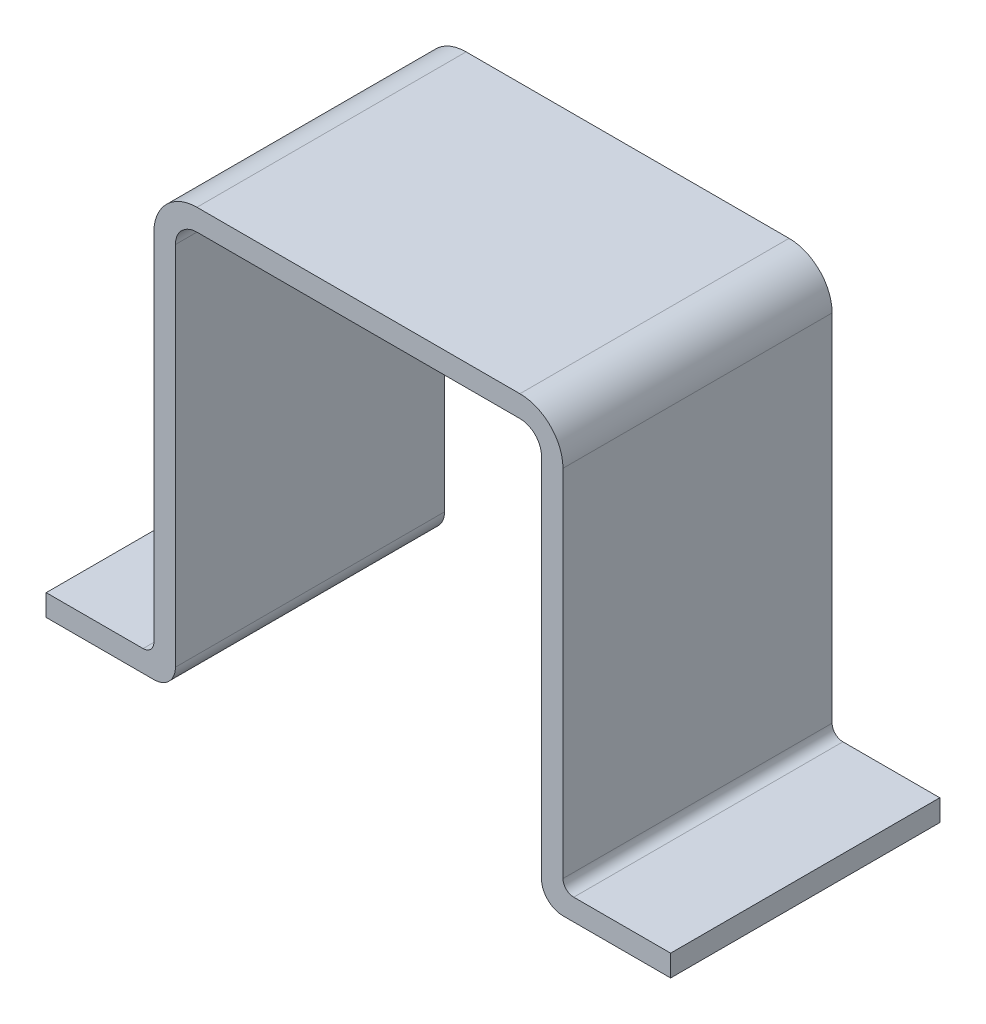
from build123d import *

# Parameters (mm, degrees)
EXTRU_MINCE1_DEPTH = 25
CONG_1_R           = 1


with BuildPart() as part:
    # Esquisse1 → Extru.-Mince1 (new body)
    with BuildSketch(Plane.XY):
        with BuildLine():
            Line((-32.373305915, 0), (-22.373305915, 0))
            ThreePointArc((-22.373305915, 0), (-20.959092353, 0.585786438), (-20.373305915, 2))
            Line((-20.373305915, 2), (-20.373305915, 36))
            ThreePointArc((-20.373305915, 36), (-19.787519478, 37.414213562), (-18.373305915, 38))
            Line((-18.373305915, 38), (11.626694085, 38))
            ThreePointArc((11.626694085, 38), (13.040907647, 37.414213562), (13.626694085, 36))
            Line((13.626694085, 36), (13.626694085, 2))
            ThreePointArc((13.626694085, 2), (14.212480522, 0.585786438), (15.626694085, 0))
            Line((15.626694085, 0), (25.626694085, 0))
            Line((25.626694085, 0), (25.626694085, 2))
            Line((25.626694085, 2), (15.626694085, 2))
            Line((15.626694085, 2), (15.626694085, 36))
            ThreePointArc((15.626694085, 36), (14.455121209, 38.828427125), (11.626694085, 40))
            Line((11.626694085, 40), (-18.373305915, 40))
            ThreePointArc((-18.373305915, 40), (-21.20173304, 38.828427125), (-22.373305915, 36))
            Line((-22.373305915, 36), (-22.373305915, 2))
            Line((-22.373305915, 2), (-32.373305915, 2))
            Line((-32.373305915, 2), (-32.373305915, 0))
        make_face()
    extrude(amount=EXTRU_MINCE1_DEPTH)

    # Congé1
    cong_1_edges = [part.edges().sort_by_distance(p)[0] for p in [
        (-22.373305915, 2, 12.5),
        (15.626694085, 2, 12.5),
    ]]
    fillet(cong_1_edges, radius=CONG_1_R)


solid = part.part
